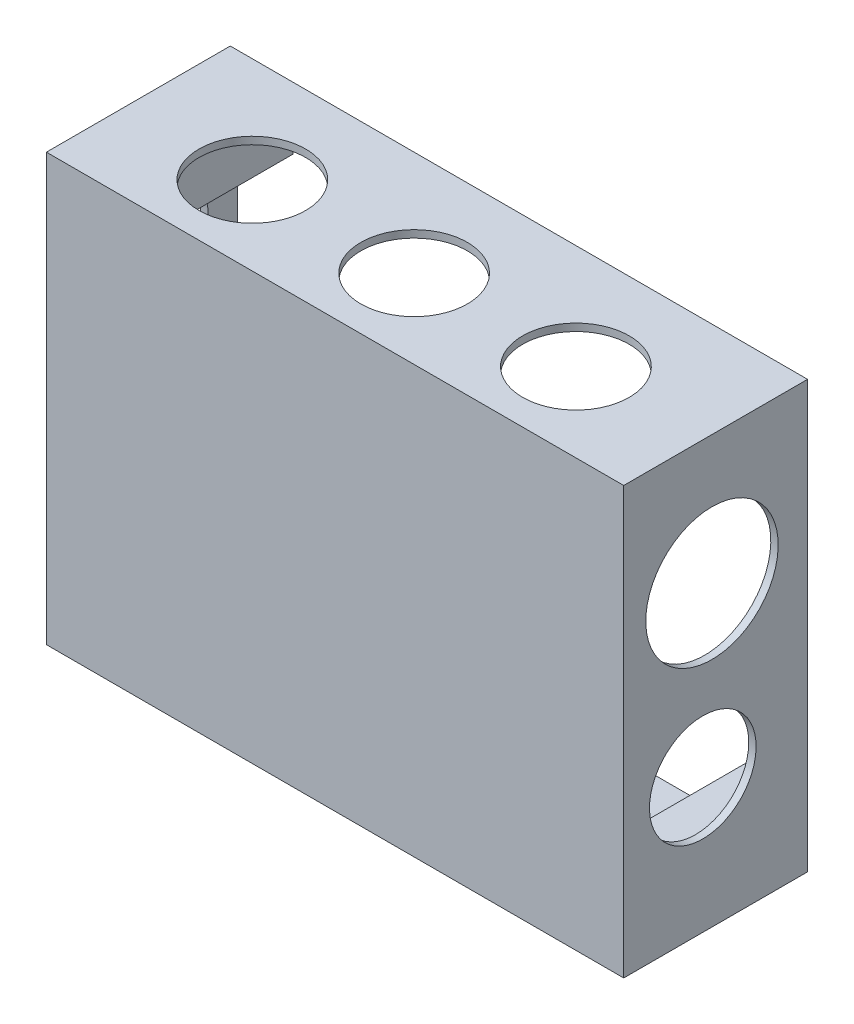
from build123d import *

# Parameters (mm, degrees)
ESQUISSE1_W             = 157
ESQUISSE1_H             = 116
BOSS_EXTRU_1_DEPTH      = 50
ENL_V_MAT_EXTRU_1_DEPTH = 48
ESQUISSE3_R             = 18
ESQUISSE3_R_2           = 14.5
ENL_V_MAT_EXTRU_2_DEPTH = 175.679706892
ESQUISSE4_R             = 14.5
ENL_V_MAT_EXTRU_3_DEPTH = 149.722056199
ESQUISSE5_R             = 3
BOSS_EXTRU_2_DEPTH      = 5


with BuildPart() as part:
    # Esquisse1 → Boss.-Extru.1 (new body)
    with BuildSketch(Plane.XY):
        Rectangle(ESQUISSE1_W, ESQUISSE1_H)
    extrude(amount=BOSS_EXTRU_1_DEPTH)

    # Esquisse2 → Enlèv. mat.-Extru.1 (cut)
    with BuildSketch(Plane.XY):
        Polygon((-61.5, 56), (61.5, 56), (61.5, 41), (76.5, 41), (76.5, -41), (61.5, -41), (61.5, -56), (-61.5, -56), (-61.5, -41), (-76.5, -41), (-76.5, 41), (-61.5, 41), align=None)
    extrude(amount=ENL_V_MAT_EXTRU_1_DEPTH, mode=Mode.SUBTRACT)

    # Esquisse3 → Enlèv. mat.-Extru.2 (cut, through all)
    with BuildSketch(Plane(origin=(78.5, 0, 0), x_dir=(0, 0, -1), z_dir=(1, 0, 0))):
        with Locations(Location((-26, 23, 0), (0, 0, 90))):
            Circle(ESQUISSE3_R)
        with Locations(Location((-28.5, -21.5, 0), (0, 0, 90))):
            Circle(ESQUISSE3_R_2)
    extrude(amount=-ENL_V_MAT_EXTRU_2_DEPTH, mode=Mode.SUBTRACT)

    # Esquisse4 → Enlèv. mat.-Extru.3 (cut, through all)
    with BuildSketch(Plane(origin=(0, 58, 0), x_dir=(1, 0, 0), z_dir=(0, 1, 0))):
        with Locations(Location((-44, -28.5, 0), (0, 0, 270))):
            Circle(ESQUISSE4_R)
        with Locations(Location((0, -28.5, 0), (0, 0, 270))):
            Circle(ESQUISSE4_R)
        with Locations(Location((44, -28.5, 0), (0, 0, 270))):
            Circle(ESQUISSE4_R)
    extrude(amount=-ENL_V_MAT_EXTRU_3_DEPTH, mode=Mode.SUBTRACT)

    # Esquisse5 → Boss.-Extru.2 (add)
    with BuildSketch(Plane(origin=(0, 0, 48), x_dir=(-1, 0, 0), z_dir=(0, 0, -1))):
        with Locations(Location((-12.5, -21, 0), (0, 0, 180))):
            Circle(ESQUISSE5_R)
        with Locations(Location((12.5, -21, 0), (0, 0, 180))):
            Circle(ESQUISSE5_R)
        with Locations(Location((12.5, 21, 0), (0, 0, 180))):
            Circle(ESQUISSE5_R)
        with Locations(Location((-12.5, 21, 0), (0, 0, 180))):
            Circle(ESQUISSE5_R)
    extrude(amount=BOSS_EXTRU_2_DEPTH)


solid = part.part
